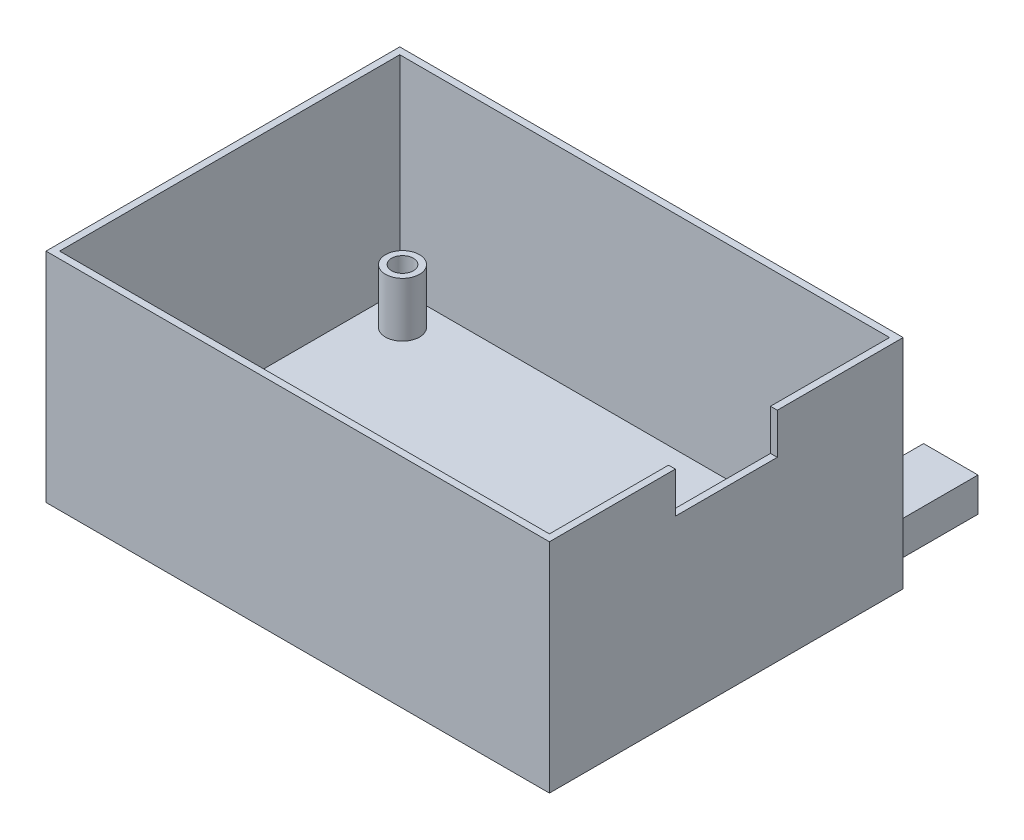
from build123d import *

# Parameters (mm, degrees)
ENCLOSURE_SHELL_SKETCH_W      = 74
ENCLOSURE_SHELL_SKETCH_H      = 52
ENCLOSURE_SHELL_FEATURE_DEPTH = 32
ENCLOSURE_GAP_SKETCH_W        = 72
ENCLOSURE_GAP_SKETCH_H        = 50
ENCLOSURE_GAP_FEATURE_DEPTH   = 30
SCREW_SHELL_SKETCH_R          = 2.5
SCREW_SHELL_FEATURE_DEPTH     = 8
SCREW_HOLE_SKETCH_R           = 1.6
SCREW_HOLE_FEATURE_DEPTH      = 8
BATTERY_CUT_REACH             = 86.711
BATTERY_CUT_DIRECTION_2_DEPTH = 85.711274338
CAMERA_CORD_HOLE_SKETCH_W     = 8
CAMERA_CORD_HOLE_SKETCH_H     = 4
CAMERA_CORD_HOLE_DEPTH        = 55.267854205
TAB_FEATURE_SKETCH_W          = 8
TAB_FEATURE_SKETCH_H          = 5
TAB_FEATURE_DEPTH             = 15


with BuildPart() as part:
    # Enclosure Shell Sketch → Enclosure Shell Feature (new body)
    with BuildSketch(Plane(origin=(0, 0, 0), x_dir=(1, 0, 0), z_dir=(0, 1, 0))):
        Rectangle(ENCLOSURE_SHELL_SKETCH_W, ENCLOSURE_SHELL_SKETCH_H)
    extrude(amount=ENCLOSURE_SHELL_FEATURE_DEPTH)

    # Enclosure Gap Sketch → Enclosure Gap Feature (cut)
    with BuildSketch(Plane(origin=(0, 32, 0), x_dir=(1, 0, 0), z_dir=(0, 1, 0))):
        Rectangle(ENCLOSURE_GAP_SKETCH_W, ENCLOSURE_GAP_SKETCH_H)
    extrude(amount=-ENCLOSURE_GAP_FEATURE_DEPTH, mode=Mode.SUBTRACT)

    # Screw Shell Sketch → Screw Shell Feature (add)
    with BuildSketch(Plane(origin=(0, 2, 0), x_dir=(1, 0, 0), z_dir=(0, 1, 0))):
        with Locations(Location((-31.096, 20.5, 0), (0, 0, 270))):
            Circle(SCREW_SHELL_SKETCH_R)
        with Locations(Location((-31.096, -20.5, 0), (0, 0, 270))):
            Circle(SCREW_SHELL_SKETCH_R)
        with Locations(Location((31.1, 20.5, 0), (0, 0, 270))):
            Circle(SCREW_SHELL_SKETCH_R)
        with Locations(Location((31.1, -20.5, 0), (0, 0, 270))):
            Circle(SCREW_SHELL_SKETCH_R)
    extrude(amount=SCREW_SHELL_FEATURE_DEPTH)

    # Screw Hole Sketch → Screw Hole Feature (cut)
    with BuildSketch(Plane(origin=(0, 10, 0), x_dir=(1, 0, 0), z_dir=(0, 1, 0))):
        with Locations(Location((-31.096, 20.5, 0), (0, 0, 270))):
            Circle(SCREW_HOLE_SKETCH_R)
        with Locations(Location((-31.096, -20.5, 0), (0, 0, 270))):
            Circle(SCREW_HOLE_SKETCH_R)
        with Locations(Location((31.1, -20.5, 0), (0, 0, 270))):
            Circle(SCREW_HOLE_SKETCH_R)
        with Locations(Location((31.1, 20.5, 0), (0, 0, 270))):
            Circle(SCREW_HOLE_SKETCH_R)
    extrude(amount=-SCREW_HOLE_FEATURE_DEPTH, mode=Mode.SUBTRACT)

    # Battery Cut Sketch → Battery Cut (cut, up to next)
    with BuildSketch(Plane.ZY.offset(-37), mode=Mode.PRIVATE) as battery_cut_sk1:
        Polygon((0, 32), (7.492527579, 32), (7.492527579, 26), (-7.5, 26), (-7.5, 32), align=None)
    battery_cut_tool1 = extrude(battery_cut_sk1.sketch, amount=BATTERY_CUT_REACH, mode=Mode.PRIVATE) & part.part
    add(battery_cut_tool1.solids().sort_by_distance((37, 29, -0.003736))[0], mode=Mode.SUBTRACT)

    # Battery Cut Sketch → Battery Cut direction 2 (cut)
    with BuildSketch(Plane.ZY.offset(-37)):
        Polygon((0, 32), (7.492527579, 32), (7.492527579, 26), (-7.5, 26), (-7.5, 32), align=None)
    extrude(amount=-BATTERY_CUT_DIRECTION_2_DEPTH, mode=Mode.SUBTRACT)

    # Camera Cord Hole Sketch → Camera Cord Hole (cut, through all)
    with BuildSketch(Plane(origin=(0, 2, 0), x_dir=(1, 0, 0), z_dir=(0, 1, 0))):
        with Locations((-17, -13)):
            Rectangle(CAMERA_CORD_HOLE_SKETCH_W, CAMERA_CORD_HOLE_SKETCH_H)
    extrude(amount=-CAMERA_CORD_HOLE_DEPTH, mode=Mode.SUBTRACT)

    # Tab Feature Sketch → Tab Feature (add)
    with BuildSketch(Plane(origin=(0, 0, -26), x_dir=(-1, 0, 0), z_dir=(0, 0, -1))):
        with Locations((-29, 2.5)):
            Rectangle(TAB_FEATURE_SKETCH_W, TAB_FEATURE_SKETCH_H)
        with Locations((29, 2.5)):
            Rectangle(TAB_FEATURE_SKETCH_W, TAB_FEATURE_SKETCH_H)
    extrude(amount=TAB_FEATURE_DEPTH)


solid = part.part
